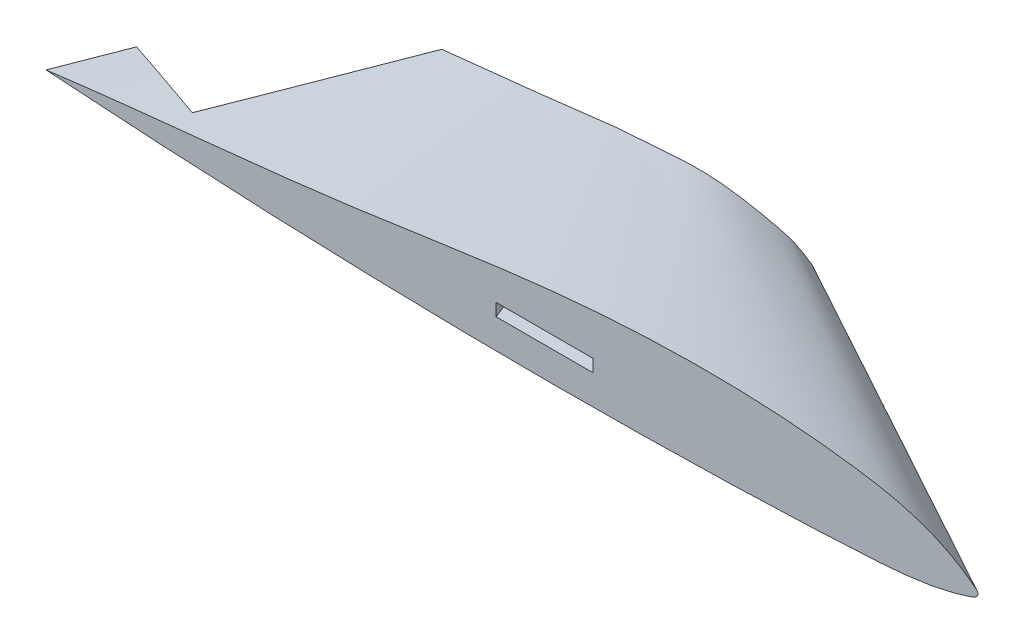
from build123d import *

# Parameters (mm, degrees)
FILLET1_R               = 6.35
CUT_EXTRUDE1_DEPTH      = 5.715
CUT_EXTRUDE2_DEPTH      = 536.224800704
CUT_EXTRUDE2_DEPTH_BACK = 536.224800704


with BuildPart() as part:
    # Sketch1 → Loft1 section 0
    with BuildSketch(Plane.XY):
        with BuildLine():
            add(Edge.make_bspline(
                [(-353.097115344, 3.76640622), (-263.60988857, 15.489732087), (-103.405625954, 27.702523148), (139.625383809, 69.731889132), (320.600909148, 70.897971745), (447.029350736, 49.156772515), (484.461992977, 32.39779841), (505.225432444, 13.29140622)],
                knots=[0, 0, 0, 0, 0.308401543, 0.542913332, 0.850169973, 0.887176211, 1, 1, 1, 1], degree=3))
            add(Edge.make_bspline(
                [(-353.097115344, 3.76640622), (-171.204173065, -8.622681299), (70.681231732, -17.726989966), (367.634485174, -8.589262826), (467.934967897, -1.634661846), (505.225432444, 13.29140622)],
                knots=[0, 0, 0, 0, 0.625313044, 0.861778666, 1, 1, 1, 1], degree=3))
        make_face()
    # Sketch2 → Loft1 section 1
    with BuildSketch(Plane.XY.offset(-180.975)):
        with BuildLine():
            add(Edge.make_bspline(
                [(-276.130119323, 8.693130358), (-231.459725957, 13.892182525), (-160.606907467, 22.045765928), (-55.21857633, 32.848239562), (-5.484684229, 39.5878223), (20.294760191, 40.734135472), (52.215253795, 43.311195196), (77.433370096, 43.854837121), (107.657853328, 39.590984865), (131.131357877, 34.766526999), (149.499224412, 30.294140301), (163.418705178, 23.059137739), (171.530279946, 16.921852673), (175.269753602, 13.29140622)],
                knots=[0, 0, 0, 0, 0.247403676, 0.462108507, 0.504395118, 0.627983171, 0.653401948, 0.743134379, 0.818760812, 0.882434425, 0.924179622, 0.96050512, 1, 1, 1, 1], degree=3))
            add(Edge.make_bspline(
                [(-276.130119323, 8.693130358), (-174.260953063, 0.911239157), (-23.669401798, 0.683864032), (127.515095646, 0.681371654), (175.269753602, 13.29140622)],
                knots=[0, 0, 0, 0, 0.67646369, 1, 1, 1, 1], degree=3))
        make_face()
    loft()

    # Fillet1
    fillet1_edges = [part.edges().sort_by_distance(p)[0] for p in [
        (340.247593023, 13.29140622, -90.4875),
    ]]
    fillet(fillet1_edges, radius=FILLET1_R)

    # Sketch7 → Cut-Extrude1 (cut, symmetric)
    with BuildSketch(Plane(origin=(0, 19.812, 0), x_dir=(1, 0, 0), z_dir=(0, 1, 0))):
        Polygon((148.552884656, 0), (75.434238435, 180.975), (-13.465761565, 180.975), (59.652884656, 0), align=None)
    extrude(amount=CUT_EXTRUDE1_DEPTH, both=True, mode=Mode.SUBTRACT)

    # Sketch8 → Cut-Extrude2 (cut, two sides: drawn at the far end of the back side and taken through both)
    with BuildSketch(Plane(origin=(0, 19.812, 0), x_dir=(1, 0, 0), z_dir=(0, 1, 0)).offset(-CUT_EXTRUDE2_DEPTH_BACK)):
        Polygon((-328.318943928, 58.261720008), (-239.497903172, 20.486951723), (-171.243818501, 180.975), (-276.130119323, 180.975), align=None)
    extrude(amount=CUT_EXTRUDE2_DEPTH + CUT_EXTRUDE2_DEPTH_BACK, mode=Mode.SUBTRACT)


solid = part.part
